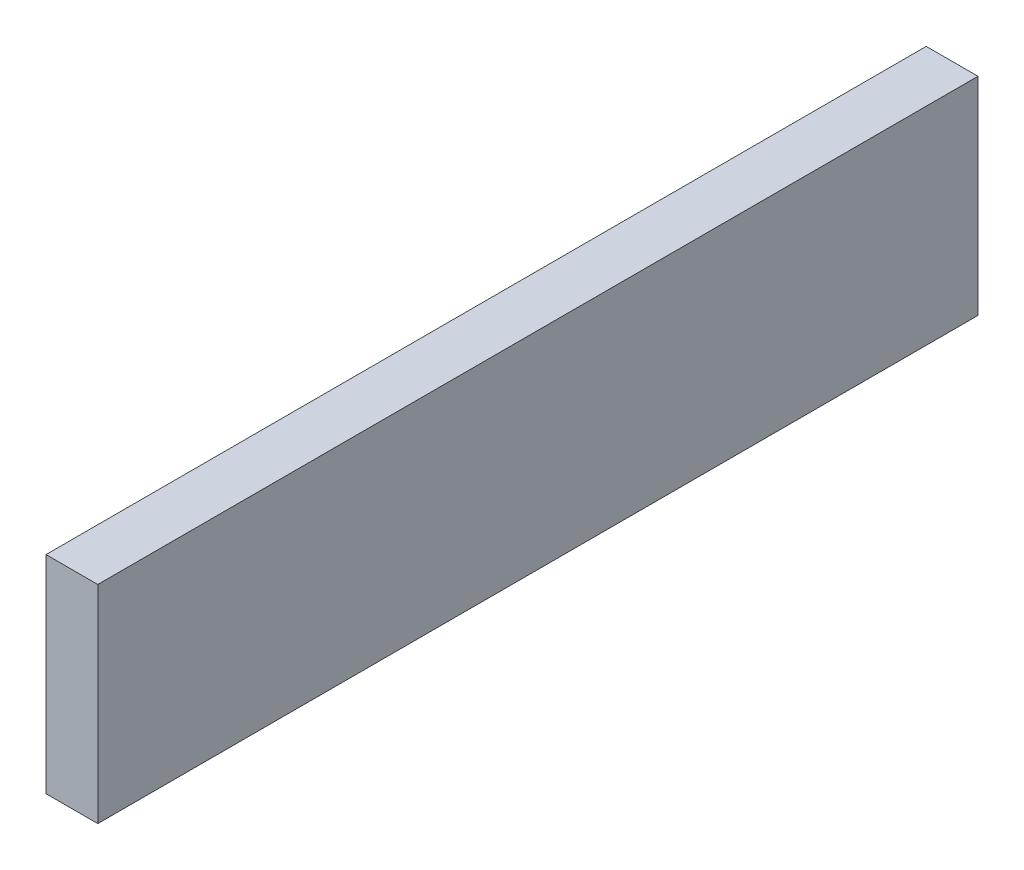
from build123d import *

# Parameters (mm, degrees)
CROQUIS1_W              = 170
CROQUIS1_H              = 40
SALIENTE_EXTRUIR1_DEPTH = 5
CROQUIS2_R              = 2.5
CORTAR_EXTRUIR1_DEPTH   = 5
CROQUIS3_R              = 2.748332181
CORTAR_EXTRUIR2_DEPTH   = 5


with BuildPart() as part:
    # Croquis1 → Saliente-Extruir1 (new, symmetric)
    with BuildSketch(Plane(origin=(0, 0, 0), x_dir=(0, 0, -1), z_dir=(1, 0, 0))):
        Rectangle(CROQUIS1_W, CROQUIS1_H)
    extrude(amount=SALIENTE_EXTRUIR1_DEPTH, both=True)

    # Croquis2 → Cortar-Extruir1 (cut)
    with BuildSketch(Plane(origin=(0, 0, 0), x_dir=(0, 0, -1), z_dir=(1, 0, 0))):
        with Locations((-80, 15)):
            Circle(CROQUIS2_R)
        with Locations((-40, 15)):
            Circle(CROQUIS2_R)
        with Locations((0, 15)):
            Circle(CROQUIS2_R)
        with Locations((40, 15)):
            Circle(CROQUIS2_R)
        with Locations((80, 15)):
            Circle(CROQUIS2_R)
        with Locations(Location((80, -15, 0), (0, 0, 180))):
            Circle(CROQUIS2_R)
        with Locations(Location((40, -15, 0), (0, 0, 180))):
            Circle(CROQUIS2_R)
        with Locations(Location((0, -15, 0), (0, 0, 180))):
            Circle(CROQUIS2_R)
        with Locations(Location((-40, -15, 0), (0, 0, 180))):
            Circle(CROQUIS2_R)
        with Locations(Location((-80, -15, 0), (0, 0, 180))):
            Circle(CROQUIS2_R)
    extrude(amount=-CORTAR_EXTRUIR1_DEPTH, mode=Mode.SUBTRACT)

    # Croquis3 → Cortar-Extruir2 (cut)
    with BuildSketch(Plane(origin=(0, 0, -85), x_dir=(-1, 0, 0), z_dir=(0, 0, -1))):
        with Locations((0, 15)):
            Circle(CROQUIS3_R)
        with Locations(Location((0, -15, 0), (0, 0, 294.543993406))):
            Circle(CROQUIS3_R)
        Circle(CROQUIS3_R)
    extrude(amount=-CORTAR_EXTRUIR2_DEPTH, mode=Mode.SUBTRACT)


solid = part.part
